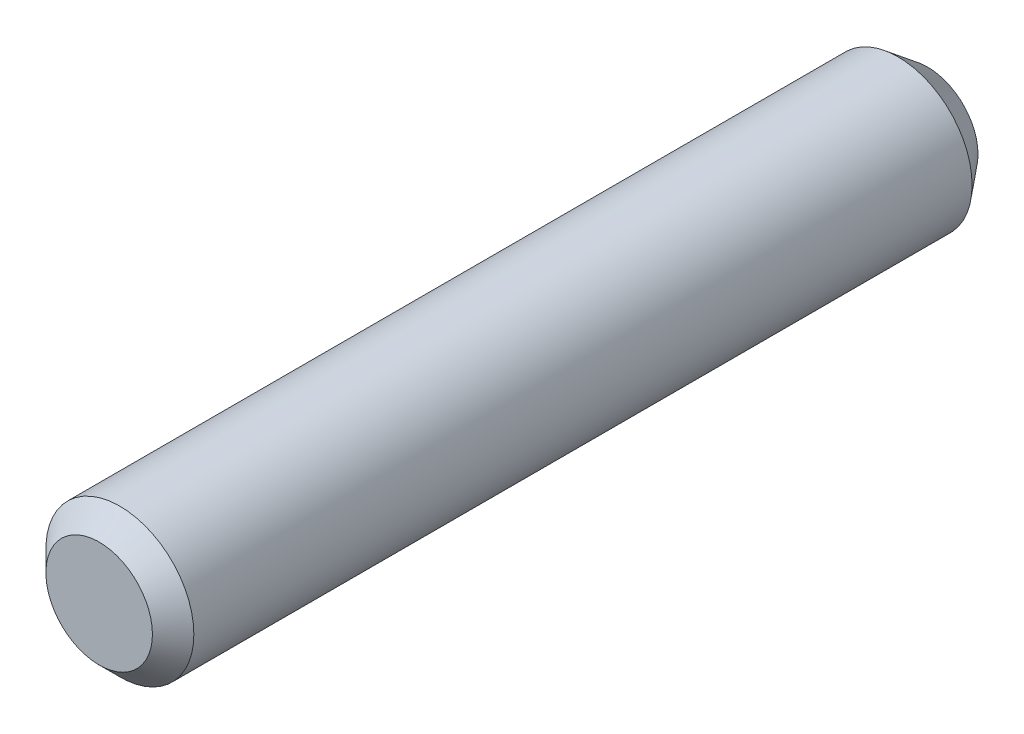
from build123d import *

# Parameters (mm, degrees)
SKETCH1_R           = 1.25
BOSS_EXTRUDE1_DEPTH = 14
CHAMFER1_SIZE       = 0.35
CHAMFER2_SIZE       = 0.4
CHAMFER2_SIZE2      = 0.5


with BuildPart() as part:
    # Sketch1 → Boss-Extrude1 (new body)
    with BuildSketch(Plane.XY):
        Circle(SKETCH1_R)
    extrude(amount=BOSS_EXTRUDE1_DEPTH)

    # Chamfer1
    chamfer1_edges = [part.edges().sort_by_distance(p)[0] for p in [
        (-1.25, 0, 14),
    ]]
    chamfer(chamfer1_edges, length=CHAMFER1_SIZE)

    # Chamfer2
    chamfer2_edges = [part.edges().sort_by_distance(p)[0] for p in [
        (-1.25, 0, 0),
    ]]
    chamfer2_side = [part.faces().sort_by_distance(p)[0] for p in [
        (0, 0, 0),
    ]]
    chamfer(chamfer2_edges, length=CHAMFER2_SIZE, length2=CHAMFER2_SIZE2, reference=chamfer2_side[0])


solid = part.part
